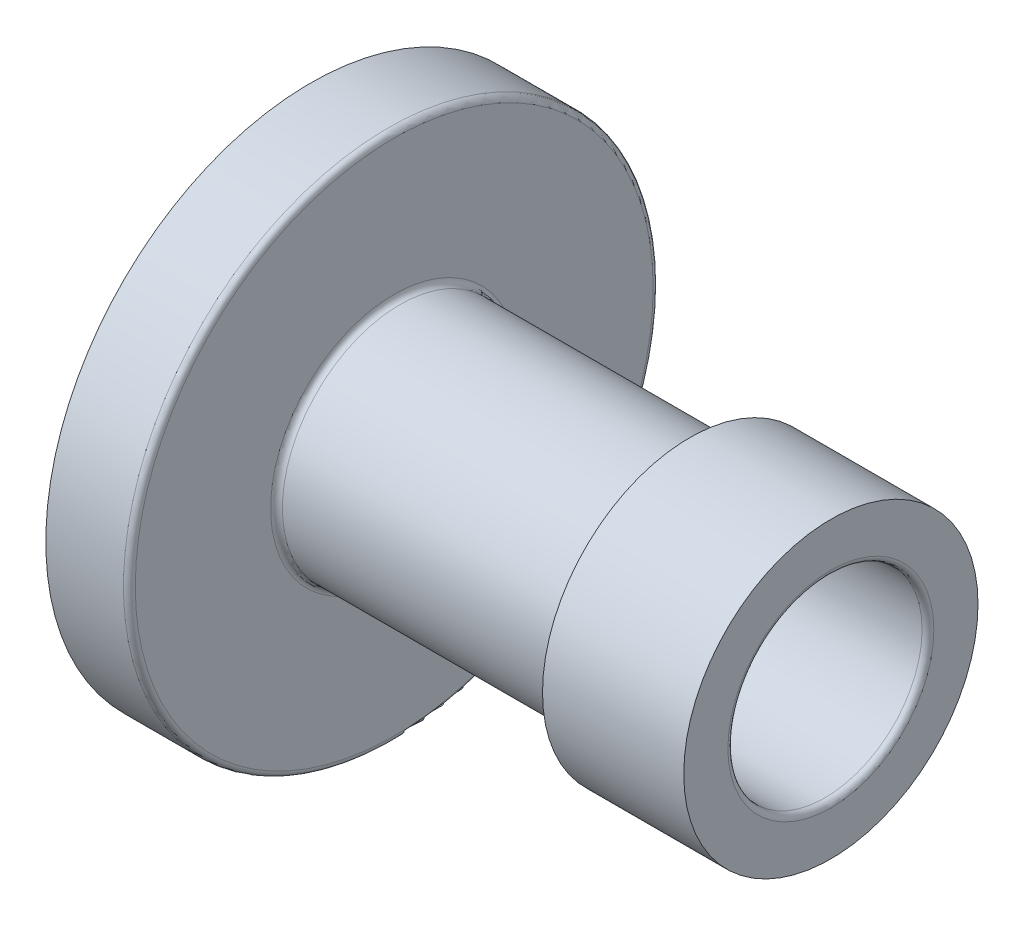
from build123d import *

# Parameters (mm, degrees)
HOLE1_D     = 30
HOLE2_D     = 33
HOLE2_DEPTH = 30
FILLET1_R   = 1


with BuildPart() as part:
    # Sketch1 → Revolve1 (revolve)
    with BuildSketch(Plane.XY, mode=Mode.PRIVATE) as revolve1_sk:
        Polygon((-44.2, 15), (-44.2, 60), (-30, 60), (-30, 35), (20.2, 35), (20.2, 40), (44.2, 40), (44.2, 15), align=None)
    revolve(revolve1_sk.sketch.rotate(Axis((44.2, 15, 0), (-1, 0, 0)), 90), axis=Axis((44.2, 15, 0), (-1, 0, 0)))

    # Hole1 (through all)
    with Locations(Plane(origin=(44.2, 0, 0), x_dir=(0, 0, -1), z_dir=(1, 0, 0))):
        with Locations((0, 15)):
            Hole(HOLE1_D / 2)

    # Hole2
    with Locations(Plane(origin=(44.2, 0, 0), x_dir=(0, 0, -1), z_dir=(1, 0, 0))):
        with Locations((0, 15)):
            Hole(HOLE2_D / 2, depth=HOLE2_DEPTH)

    # Fillet1
    fillet1_edges = [part.edges().sort_by_distance(p)[0] for p in [
        (44.2, 15, -16.5),
        (-30, 15, 20),
        (-30, 15, 45),
    ]]
    fillet(fillet1_edges, radius=FILLET1_R)


solid = part.part
